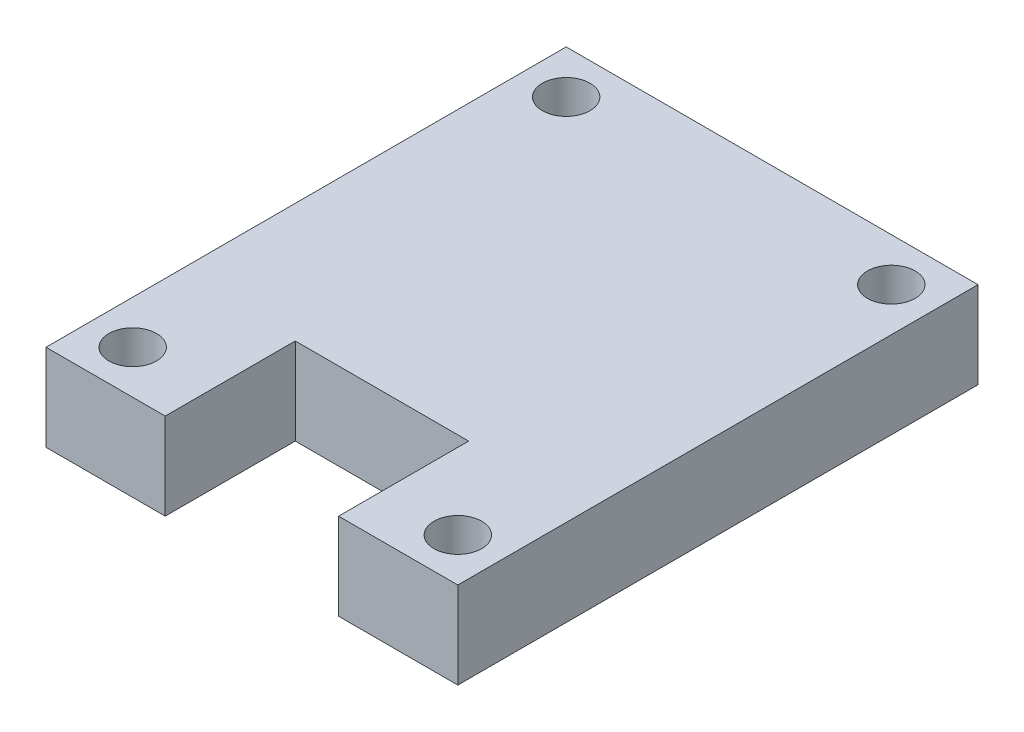
from build123d import *

# Parameters (mm, degrees)
ESQUISSE1_W             = 38
ESQUISSE1_H             = 48
BOSS_EXTRU_1_DEPTH      = 8
ESQUISSE3_R             = 2.2
ENL_V_MAT_EXTRU_1_DEPTH = 8
ENL_V_MAT_EXTRU_2_DEPTH = 8


with BuildPart() as part:
    # Esquisse1 → Boss.-Extru.1 (new body)
    with BuildSketch(Plane(origin=(0, 0, 0), x_dir=(1, 0, 0), z_dir=(0, 1, 0))):
        with Locations((19, 24)):
            Rectangle(ESQUISSE1_W, ESQUISSE1_H)
    extrude(amount=BOSS_EXTRU_1_DEPTH)

    # Esquisse3 → Enlèv. mat.-Extru.1 (cut)
    with BuildSketch(Plane.XZ):
        with Locations(Location((4, -4, 0), (0, 0, 270))):
            Circle(ESQUISSE3_R)
        with Locations(Location((34, -4, 0), (0, 0, 270))):
            Circle(ESQUISSE3_R)
        with Locations(Location((34, -44, 0), (0, 0, 270))):
            Circle(ESQUISSE3_R)
        with Locations(Location((4, -44, 0), (0, 0, 270))):
            Circle(ESQUISSE3_R)
    extrude(amount=-ENL_V_MAT_EXTRU_1_DEPTH, mode=Mode.SUBTRACT)

    # Esquisse5 → Enlèv. mat.-Extru.2 (cut)
    with BuildSketch(Plane(origin=(0, 8, 0), x_dir=(1, 0, 0), z_dir=(0, 1, 0))):
        Polygon((19, 12), (27, 12), (27, 0), (11, 0), (11, 12), align=None)
    extrude(amount=-ENL_V_MAT_EXTRU_2_DEPTH, mode=Mode.SUBTRACT)


solid = part.part
